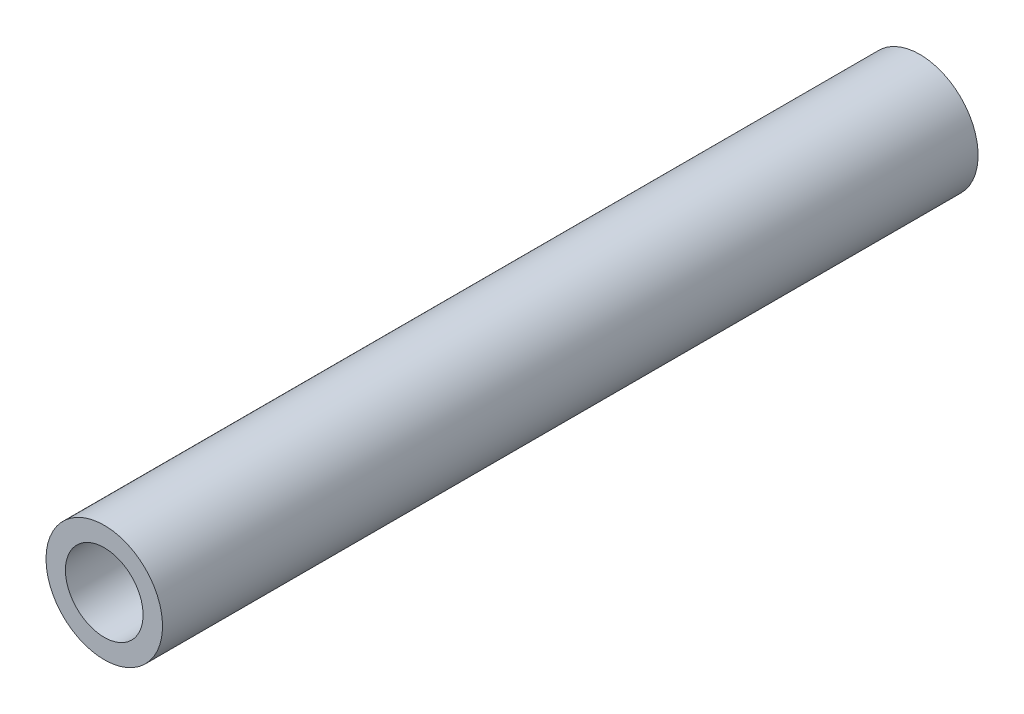
from build123d import *

# Parameters (mm, degrees)
SCHIZZO2_R                   = 3
SCHIZZO2_R_2                 = 2
ESTRUSIONE_ESTRUSIONE1_DEPTH = 42


with BuildPart() as part:
    # Schizzo2 → Estrusione-Estrusione1 (new body)
    with BuildSketch(Plane.XY):
        with Locations(Location((13, -54.5, 0), (0, 0, 180))):
            Circle(SCHIZZO2_R)
        with Locations(Location((13, -54.5, 0), (0, 0, 180))):
            Circle(SCHIZZO2_R_2, mode=Mode.SUBTRACT)
    extrude(amount=ESTRUSIONE_ESTRUSIONE1_DEPTH)


solid = part.part
